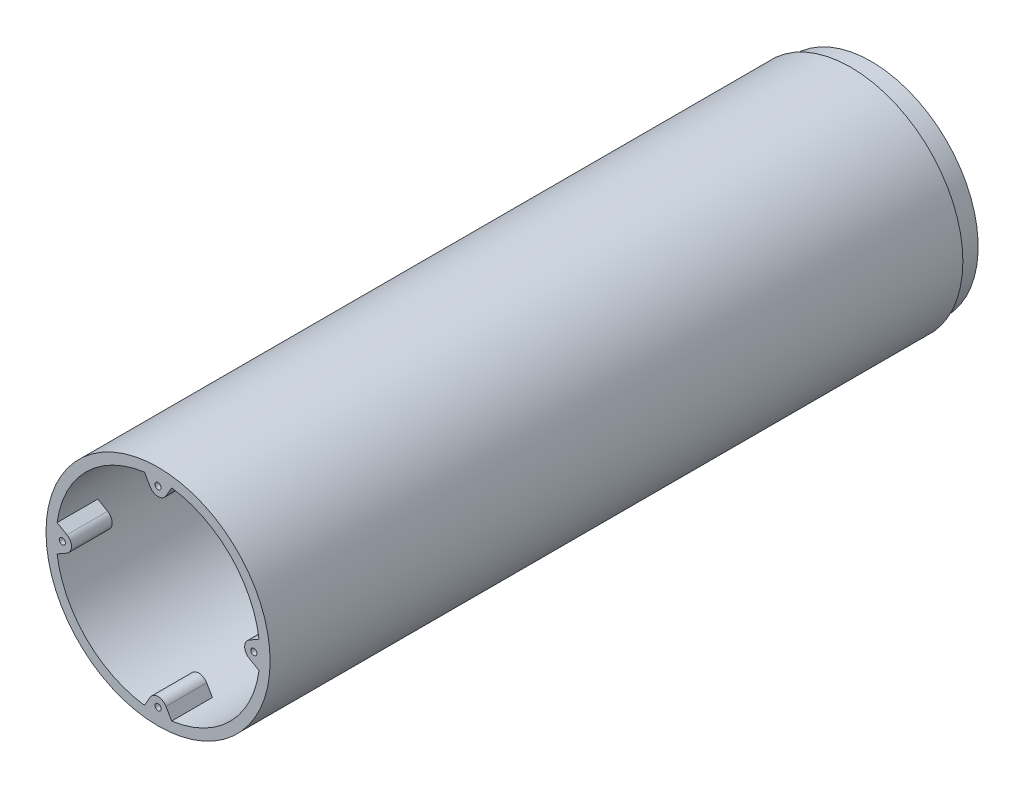
from build123d import *

# Parameters (mm, degrees)
SKETCH_2_R          = 55
SKETCH_2_R_2        = 50
EXTRUDE_1_DEPTH     = 350
SKETCH_1_R          = 55
SKETCH_1_R_2        = 1.5
EXTRUDE_2_DEPTH     = 20
CUT_EXTRUDE_1_DEPTH = 2
SKETCH_4_R          = 55
SKETCH_4_R_2        = 52.5
CUT_EXTRUDE_2_DEPTH = 10


with BuildPart() as part:
    # 草图2 → 凸台-拉伸1 (new body)
    with BuildSketch(Plane.XY):
        Circle(SKETCH_2_R)
        Circle(SKETCH_2_R_2, mode=Mode.SUBTRACT)
    extrude(amount=EXTRUDE_1_DEPTH)

    # 草图1 → 凸台-拉伸2 (add)
    with BuildSketch(Plane.XY):
        Circle(SKETCH_1_R)
        with Locations((0, -47)):
            Circle(SKETCH_1_R_2, mode=Mode.SUBTRACT)
        with Locations((47, 0)):
            Circle(SKETCH_1_R_2, mode=Mode.SUBTRACT)
        with Locations((0, 47)):
            Circle(SKETCH_1_R_2, mode=Mode.SUBTRACT)
        with Locations((-47, 0)):
            Circle(SKETCH_1_R_2, mode=Mode.SUBTRACT)
        with BuildLine():
            Line((-6.670179488, -49.553089768), (-3.897114317, -44.75))
            ThreePointArc((-3.897114317, -44.75), (0, -42.5), (3.897114317, -44.75))
            Line((3.897114317, -44.75), (6.670179488, -49.553089768))
            ThreePointArc((6.670179488, -49.553089768), (35.355339059, -35.355339059), (49.553089768, -6.670179488))
            Line((49.553089768, -6.670179488), (44.75, -3.897114317))
            ThreePointArc((44.75, -3.897114317), (42.5, 0), (44.75, 3.897114317))
            Line((44.75, 3.897114317), (49.553089768, 6.670179488))
            ThreePointArc((49.553089768, 6.670179488), (35.355339059, 35.355339059), (6.670179488, 49.553089768))
            Line((6.670179488, 49.553089768), (3.897114317, 44.75))
            ThreePointArc((3.897114317, 44.75), (0, 42.5), (-3.897114317, 44.75))
            Line((-3.897114317, 44.75), (-6.670179488, 49.553089768))
            ThreePointArc((-6.670179488, 49.553089768), (-35.355339059, 35.355339059), (-49.553089768, 6.670179488))
            Line((-49.553089768, 6.670179488), (-44.75, 3.897114317))
            ThreePointArc((-44.75, 3.897114317), (-42.5, 0), (-44.75, -3.897114317))
            Line((-44.75, -3.897114317), (-49.553089768, -6.670179488))
            ThreePointArc((-49.553089768, -6.670179488), (-35.355339059, -35.355339059), (-6.670179488, -49.553089768))
        make_face(mode=Mode.SUBTRACT)
    extrude_2 = extrude(amount=EXTRUDE_2_DEPTH)

    # 草图3 → 切除-拉伸1 (cut)
    with BuildSketch(Plane.XY.offset(20)):
        Polygon((-1.58771324, 44.25), (1.58771324, 44.25), (3.175426481, 47), (1.58771324, 49.75), (-1.58771324, 49.75), (-3.175426481, 47), align=None)
        Polygon((-44.25, -1.58771324), (-44.25, 1.58771324), (-47, 3.175426481), (-49.75, 1.58771324), (-49.75, -1.58771324), (-47, -3.175426481), align=None)
        Polygon((44.25, 1.58771324), (44.25, -1.58771324), (47, -3.175426481), (49.75, -1.58771324), (49.75, 1.58771324), (47, 3.175426481), align=None)
        Polygon((1.58771324, -44.25), (-1.58771324, -44.25), (-3.175426481, -47), (-1.58771324, -49.75), (1.58771324, -49.75), (3.175426481, -47), align=None)
    cut_extrude_1 = extrude(amount=-CUT_EXTRUDE_1_DEPTH, mode=Mode.SUBTRACT)

    # 镜向1: 凸台-拉伸2, 切除-拉伸1 across plane
    add(extrude_2.mirror(Plane(origin=(0, 0, 175), x_dir=(1, 0, 0), z_dir=(0, 0, -1))))
    add(cut_extrude_1.mirror(Plane(origin=(0, 0, 175), x_dir=(1, 0, 0), z_dir=(0, 0, -1))), mode=Mode.SUBTRACT)

    # 草图4 → 切除-拉伸2 (cut)
    with BuildSketch(Plane(origin=(0, 0, 0), x_dir=(-1, 0, 0), z_dir=(0, 0, -1))):
        Circle(SKETCH_4_R)
        Circle(SKETCH_4_R_2, mode=Mode.SUBTRACT)
    extrude(amount=-CUT_EXTRUDE_2_DEPTH, mode=Mode.SUBTRACT)


solid = part.part
